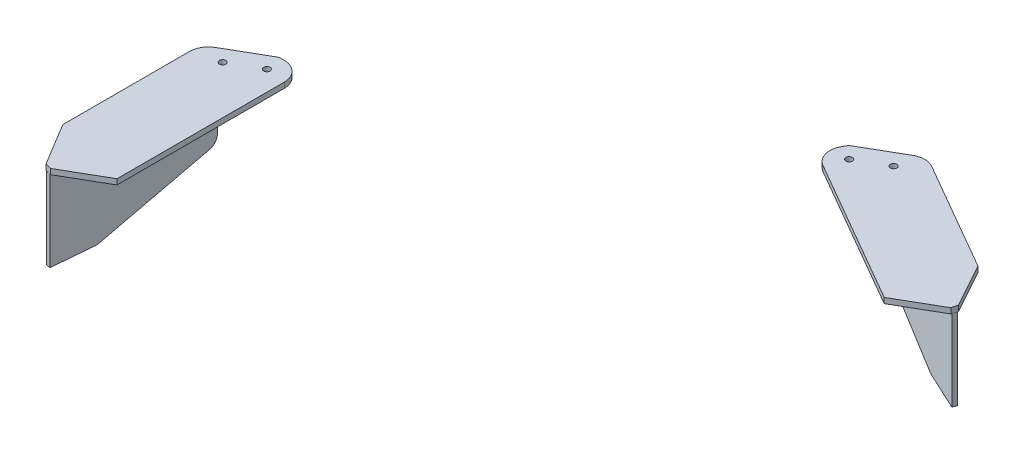
from build123d import *

# Parameters (mm, degrees)
SKETCH1_R           = 6
BOSS_EXTRUDE1_DEPTH = 10
EXTRUDE_THIN1_DEPTH = 150
CUT_EXTRUDE1_DEPTH  = 8
FILLET1_R           = 20


with BuildPart() as part:
    # Sketch1 → Boss-Extrude1 (new body)
    with BuildSketch(Plane(origin=(0, 0, 0), x_dir=(1, 0, 0), z_dir=(0, 1, 0))):
        with BuildLine():
            Line((23.921775059, 194.44), (-50.80127019, 151.298629711))
            ThreePointArc((-50.80127019, 151.298629711), (-63.612159322, 138.487740578), (-68.30127019, 120.987740578))
            Line((-68.30127019, 120.987740578), (-68.30127019, -112.84))
            Line((-68.30127019, -112.84), (-20.842811266, -191.438488045))
            Line((-20.842811266, -191.438488045), (-9.641016151, -194.44))
            Line((-9.641016151, -194.44), (68.30127019, -149.44))
            Line((68.30127019, -149.44), (68.30127019, 159.44))
            ThreePointArc((68.30127019, 159.44), (58.050007532, 184.188737342), (33.30127019, 194.44))
            Line((33.30127019, 194.44), (23.921775059, 194.44))
        make_face()
        with Locations(Location((31.55, 164.203141572, 0), (0, 0, 270))):
            Circle(SKETCH1_R, mode=Mode.SUBTRACT)
        with Locations(Location((-20.411524227, 134.203141572, 0), (0, 0, 270))):
            Circle(SKETCH1_R, mode=Mode.SUBTRACT)
    extrude(amount=BOSS_EXTRUDE1_DEPTH)


with BuildPart() as body_2:
    # Sketch2 → Extrude-Thin1 (new body)
    with BuildSketch(Plane.XZ):
        Polygon((-19.2266925, 192.590621052), (5.612694183, -91.324867905), (13.582251767, -90.627621963), (-11.257134916, 193.287866994), align=None)
    extrude(amount=EXTRUDE_THIN1_DEPTH)

    # Sketch3 → Cut-Extrude1 (cut)
    with BuildSketch(Plane(origin=(5.610418606, 0, 0.490848026), x_dir=(0.08715574274766193, 0, -0.9961946980917453), z_dir=(0.9961946980917453, 0, 0.08715574274766193))):
        Polygon((91.466527741, -150), (-113.533472259, -150), (91.466527741, -80), align=None)
    extrude(amount=-CUT_EXTRUDE1_DEPTH, mode=Mode.SUBTRACT)

    # Fillet1
    fillet1_edges = [body_2.edges().sort_by_distance(p)[0] for p in [
        (-8.269454288, -150, 113.243668175),
        (9.597472975, -80, -90.976244934),
    ]]
    fillet(fillet1_edges, radius=FILLET1_R)


with BuildPart() as body_3:
    # Mirror2: mirrored copy
    add(part.part.mirror(Plane(origin=(435.6525, 0, -251.524088148), x_dir=(0.49999999999999495, 0, 0.8660254037844416), z_dir=(-0.8660254037844416, 0, 0.49999999999999495))))


with BuildPart() as body_4:
    # Mirror2 2: mirrored copy
    add(body_2.part.mirror(Plane(origin=(435.6525, 0, -251.524088148), x_dir=(0.49999999999999495, 0, 0.8660254037844416), z_dir=(-0.8660254037844416, 0, 0.49999999999999495))))


solid = Compound([part.part, body_2.part, body_3.part, body_4.part])
